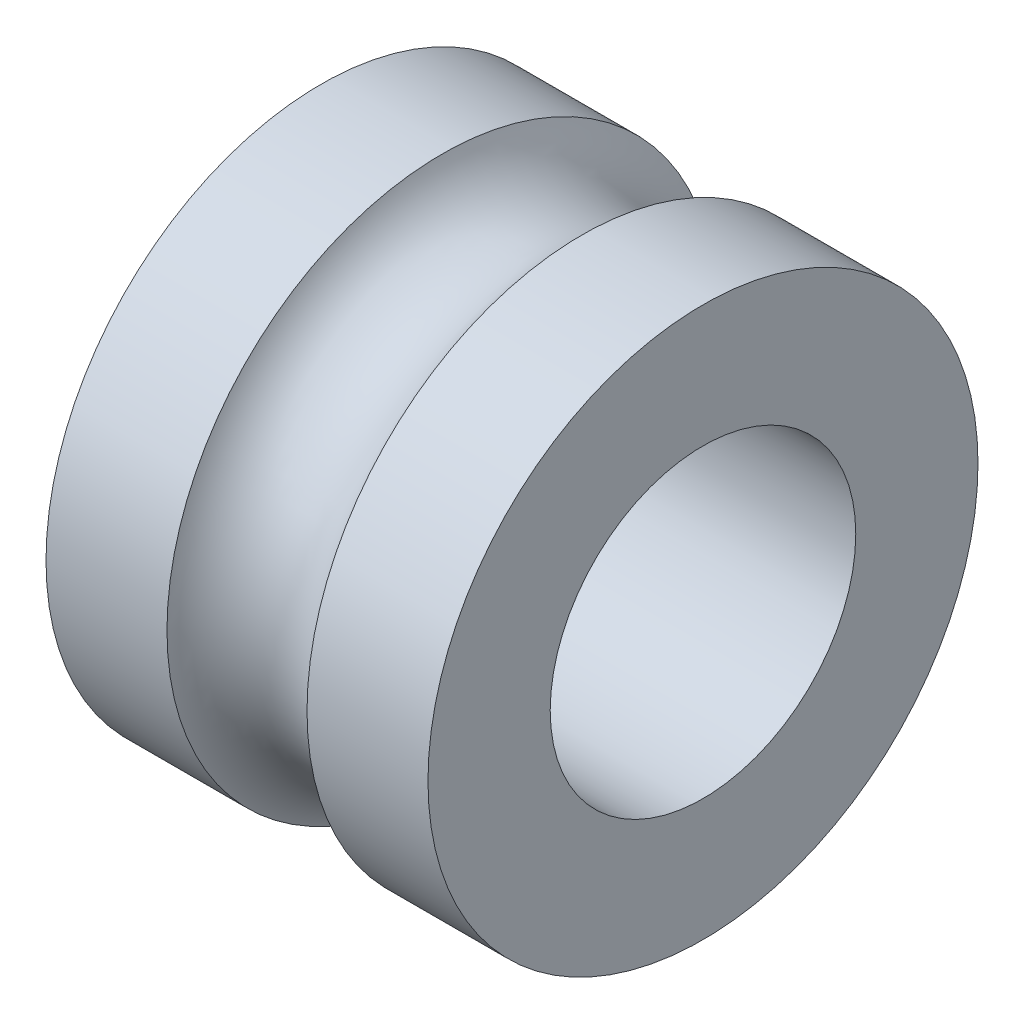
from build123d import *


with BuildPart() as part:
    # Esquisse1 → Révolution2 (revolve)
    with BuildSketch(Plane.XY, mode=Mode.PRIVATE) as r_volution2_sk:
        with BuildLine():
            Line((4.582575695, 18), (12.5, 18))
            Line((12.5, 18), (12.5, 10))
            Line((12.5, 10), (-12.5, 10))
            Line((-12.5, 10), (-12.5, 18))
            Line((-12.5, 18), (-4.582575695, 18))
            ThreePointArc((-4.582575695, 18), (0, 15), (4.582575695, 18))
        make_face()
    revolve(r_volution2_sk.sketch.rotate(Axis((-36.435479179, 0, 0), (1, 0, 0)), 90), axis=Axis((-36.435479179, 0, 0), (1, 0, 0)))


solid = part.part
